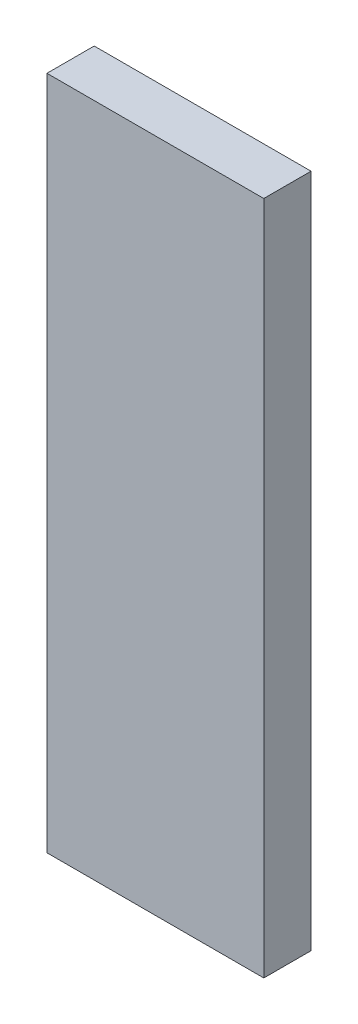
from build123d import *

# Parameters (mm, degrees)
SKETCH1_W           = 32.12
SKETCH1_H           = 100
BOSS_EXTRUDE1_DEPTH = 7


with BuildPart() as part:
    # Sketch1 → Boss-Extrude1 (new body)
    with BuildSketch(Plane.XY):
        with Locations((-5.658230088, -18.910265487)):
            Rectangle(SKETCH1_W, SKETCH1_H)
    extrude(amount=BOSS_EXTRUDE1_DEPTH)


solid = part.part
